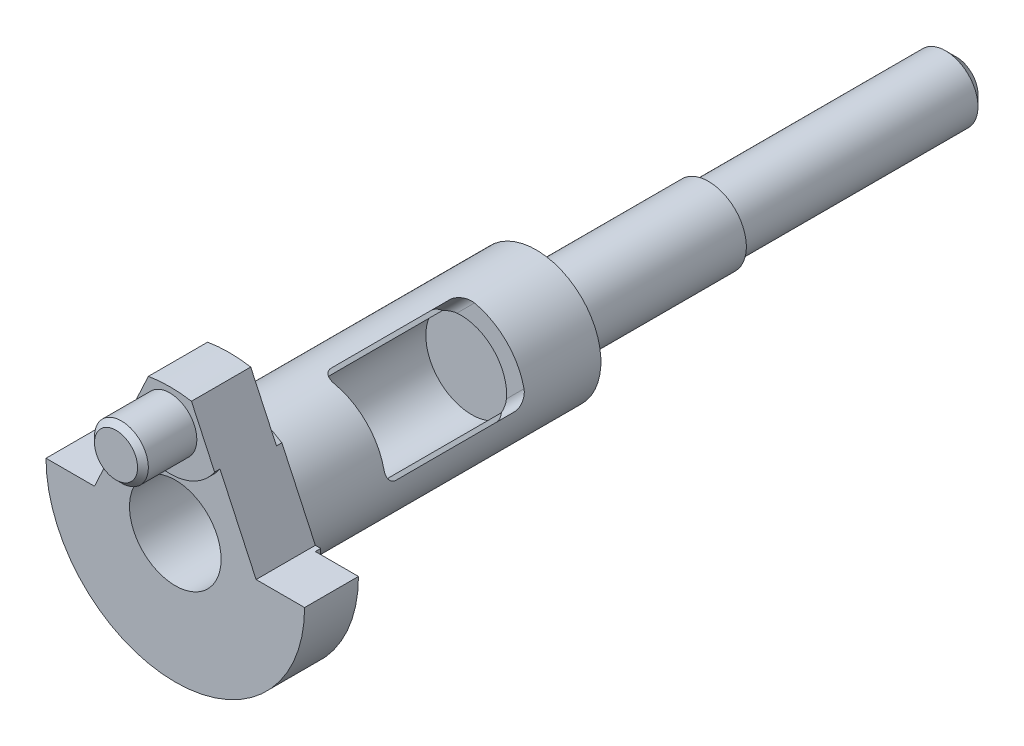
from build123d import *

# Parameters (mm, degrees)
BASE_EXTRUSION_DEPTH    = 5
BOSS_EXTRU_1_DEPTH      = 0.5
ESQUISSE3_R             = 2.5
BOSS_EXTRU_2_DEPTH      = 5
BOSS_EXTRU_3_DEPTH      = 0.5
ESQUISSE5_R             = 6
BOSS_EXTRU_4_DEPTH      = 28
ESQUISSE6_R             = 3.5
BOSS_EXTRU_5_DEPTH      = 16
ESQUISSE7_R             = 3
BOSS_EXTRU_6_DEPTH      = 23
CHANFREIN1_SIZE         = 1
ESQUISSE8_R             = 4.25
ENL_V_MAT_EXTRU_1_DEPTH = 28
ENL_V_MAT_EXTRU_4_DEPTH = 4.25
CHANFREIN2_SIZE         = 0.5


with BuildPart() as part:
    # Esquisse1 → Base-Extrusion (new body)
    with BuildSketch(Plane.XY):
        with BuildLine():
            Line((2, 11.832159566), (7.5, 0))
            Line((7.5, 0), (12, 0))
            ThreePointArc((12, 0), (0, -12), (-12, 0))
            Line((-12, 0), (-7.5, 0))
            Line((-7.5, 0), (-2, 11.832159566))
            ThreePointArc((-2, 11.832159566), (0, 12), (2, 11.832159566))
        make_face()
    extrude(amount=BASE_EXTRUSION_DEPTH)

    # Esquisse2 → Boss.-Extru.1 (add)
    with BuildSketch(Plane.XY.offset(5)):
        with BuildLine():
            Line((2, 11.832159566), (4.148812154, 7.209416242))
            ThreePointArc((4.148812154, 7.209416242), (0, 5), (-4.148812154, 7.209416242))
            Line((-4.148812154, 7.209416242), (-2, 11.832159566))
            ThreePointArc((-2, 11.832159566), (0, 12), (2, 11.832159566))
        make_face()
    extrude(amount=BOSS_EXTRU_1_DEPTH)

    # Esquisse3 → Boss.-Extru.2 (add)
    with BuildSketch(Plane.XY.offset(5.5)):
        with Locations((0, 9)):
            Circle(ESQUISSE3_R)
    extrude(amount=BOSS_EXTRU_2_DEPTH)

    # Esquisse4 → Boss.-Extru.3 (add)
    with BuildSketch(Plane(origin=(0, 0, 0), x_dir=(-1, 0, 0), z_dir=(0, 0, -1))):
        with BuildLine():
            Line((-8, 0), (-7.5, 0))
            Line((-7.5, 0), (-4.391777187, 6.686725143))
            ThreePointArc((-4.391777187, 6.686725143), (0, 8), (4.391777187, 6.686725143))
            Line((4.391777187, 6.686725143), (7.5, 0))
            Line((7.5, 0), (8, 0))
            ThreePointArc((8, 0), (0, -8), (-8, 0))
        make_face()
    extrude(amount=BOSS_EXTRU_3_DEPTH)

    # Esquisse5 → Boss.-Extru.4 (add)
    with BuildSketch(Plane(origin=(0, 0, -0.5), x_dir=(-1, 0, 0), z_dir=(0, 0, -1))):
        Circle(ESQUISSE5_R)
    extrude(amount=BOSS_EXTRU_4_DEPTH)

    # Esquisse6 → Boss.-Extru.5 (add)
    with BuildSketch(Plane(origin=(0, 0, -28.5), x_dir=(-1, 0, 0), z_dir=(0, 0, -1))):
        Circle(ESQUISSE6_R)
    extrude(amount=BOSS_EXTRU_5_DEPTH)

    # Esquisse7 → Boss.-Extru.6 (add)
    with BuildSketch(Plane(origin=(0, 0, -44.5), x_dir=(-1, 0, 0), z_dir=(0, 0, -1))):
        Circle(ESQUISSE7_R)
    extrude(amount=BOSS_EXTRU_6_DEPTH)

    # Chanfrein1
    chanfrein1_edges = [part.edges().sort_by_distance(p)[0] for p in [
        (3, 0, -67.5),
    ]]
    chamfer(chanfrein1_edges, length=CHANFREIN1_SIZE)

    # Esquisse8 → Enlèv. mat.-Extru.1 (cut)
    with BuildSketch(Plane.XY.offset(5.5)):
        Circle(ESQUISSE8_R)
    extrude(amount=-ENL_V_MAT_EXTRU_1_DEPTH, mode=Mode.SUBTRACT)

    # Esquisse12 → Enlèv. mat.-Extru.4 (cut)
    with BuildSketch(Plane(origin=(4.242640687, 4.242640687, -14.5), x_dir=(-0.7071067811865462, 0.7071067811865489, 0), z_dir=(0.7071067811865489, 0.7071067811865462, 0))):
        with BuildLine():
            Line((-3.25, 6), (3.25, 6))
            ThreePointArc((3.25, 6), (3.957106781, 5.707106781), (4.25, 5))
            Line((4.25, 5), (4.25, -6))
            ThreePointArc((4.25, -6), (3.957106781, -6.707106781), (3.25, -7))
            Line((3.25, -7), (-3.25, -7))
            ThreePointArc((-3.25, -7), (-3.957106781, -6.707106781), (-4.25, -6))
            Line((-4.25, -6), (-4.25, 5))
            ThreePointArc((-4.25, 5), (-3.957106781, 5.707106781), (-3.25, 6))
        make_face()
    extrude(amount=-ENL_V_MAT_EXTRU_4_DEPTH, mode=Mode.SUBTRACT)

    # Chanfrein2
    chanfrein2_edges = [part.edges().sort_by_distance(p)[0] for p in [
        (-2.5, 9, 10.5),
    ]]
    chamfer(chanfrein2_edges, length=CHANFREIN2_SIZE)


solid = part.part
